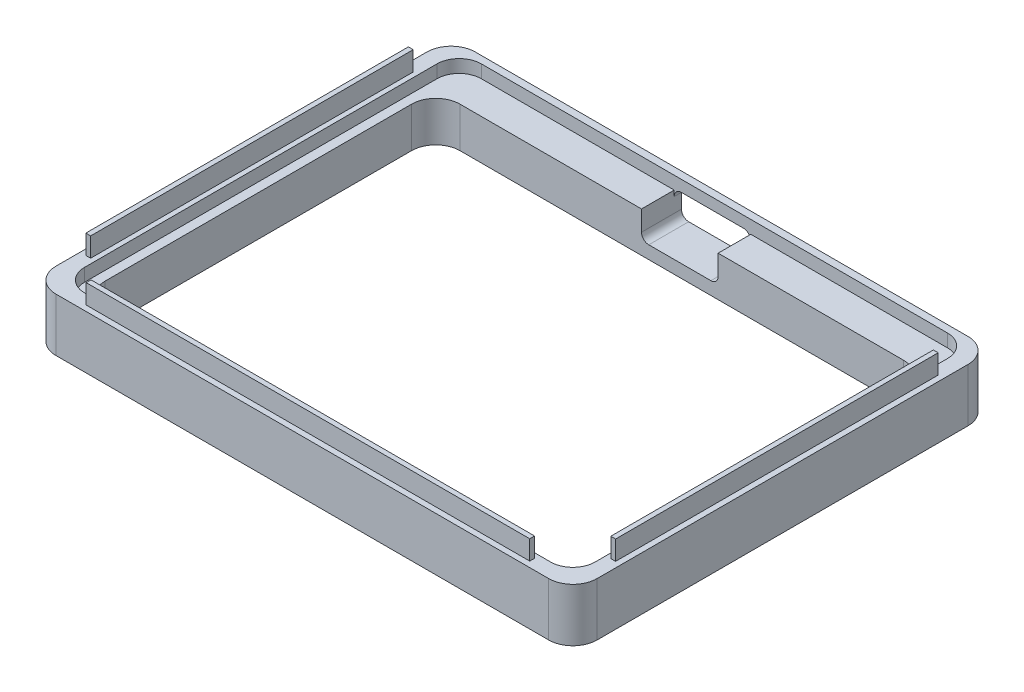
from build123d import *

# Parameters (mm, degrees)
BOSS_EXTRUDE1_DEPTH = 6.6
CUT_EXTRUDE1_DEPTH  = 6.6
CUT_EXTRUDE2_DEPTH  = 1.6
CUT_EXTRUDE3_DEPTH  = 11.6
SKETCH5_W           = 9.5
SKETCH5_H           = 4.05
CUT_EXTRUDE4_DEPTH  = 2
SKETCH6_W           = 0.75
SKETCH6_H           = 40
SKETCH6_W_2         = 55
SKETCH6_H_2         = 0.75
CUT_EXTRUDE5_DEPTH  = 2.6
SKETCH7_W           = 0.6
SKETCH7_H           = 40
SKETCH7_W_2         = 55
SKETCH7_H_2         = 0.6
BOSS_EXTRUDE2_DEPTH = 2.4


with BuildPart() as part:
    # Sketch1 → Boss-Extrude1 (new body)
    with BuildSketch(Plane(origin=(0, 0, 0), x_dir=(1, 0, 0), z_dir=(0, 1, 0))):
        with BuildLine():
            Line((3, 0), (64.1, 0))
            ThreePointArc((64.1, 0), (66.221320344, 0.878679656), (67.1, 3))
            Line((67.1, 3), (67.1, 49))
            ThreePointArc((67.1, 49), (66.221320344, 51.121320344), (64.1, 52))
            Line((64.1, 52), (3, 52))
            ThreePointArc((3, 52), (0.878679656, 51.121320344), (0, 49))
            Line((0, 49), (0, 3))
            ThreePointArc((0, 3), (0.878679656, 0.878679656), (3, 0))
        make_face()
    extrude(amount=BOSS_EXTRUDE1_DEPTH)

    # Sketch2 → Cut-Extrude1 (cut)
    with BuildSketch(Plane(origin=(0, 6.6, 0), x_dir=(1, 0, 0), z_dir=(0, 1, 0))):
        with BuildLine():
            Line((6.05, 3.05), (61.05, 3.05))
            ThreePointArc((61.05, 3.05), (63.171320344, 3.928679656), (64.05, 6.05))
            Line((64.05, 6.05), (64.05, 44.05))
            ThreePointArc((64.05, 44.05), (63.171320344, 46.171320344), (61.05, 47.05))
            Line((61.05, 47.05), (6.05, 47.05))
            ThreePointArc((6.05, 47.05), (3.928679656, 46.171320344), (3.05, 44.05))
            Line((3.05, 44.05), (3.05, 6.05))
            ThreePointArc((3.05, 6.05), (3.928679656, 3.928679656), (6.05, 3.05))
        make_face()
    extrude(amount=-CUT_EXTRUDE1_DEPTH, mode=Mode.SUBTRACT)

    # Sketch3 → Cut-Extrude2 (cut)
    with BuildSketch(Plane(origin=(0, 6.6, 0), x_dir=(1, 0, 0), z_dir=(0, 1, 0))):
        with BuildLine():
            Line((4.65, 51.1), (62.45, 51.1))
            ThreePointArc((62.45, 51.1), (64.394543648, 50.294543648), (65.2, 48.35))
            Line((65.2, 48.35), (65.2, 4.65))
            ThreePointArc((65.2, 4.65), (64.394543648, 2.705456352), (62.45, 1.9))
            Line((62.45, 1.9), (4.65, 1.9))
            ThreePointArc((4.65, 1.9), (2.705456352, 2.705456352), (1.9, 4.65))
            Line((1.9, 4.65), (1.9, 48.35))
            ThreePointArc((1.9, 48.35), (2.705456352, 50.294543648), (4.65, 51.1))
        make_face()
    extrude(amount=-CUT_EXTRUDE2_DEPTH, mode=Mode.SUBTRACT)

    # Sketch4 → Cut-Extrude3 (cut)
    with BuildSketch(Plane(origin=(0, 0, -52), x_dir=(-1, 0, 0), z_dir=(0, 0, -1))):
        with BuildLine():
            Line((-37.16, 5.2), (-29.46, 5.2))
            ThreePointArc((-29.46, 5.2), (-28.823603897, 4.936396103), (-28.56, 4.3))
            Line((-28.56, 4.3), (-28.56, 2.5))
            ThreePointArc((-28.56, 2.5), (-28.823603897, 1.863603897), (-29.46, 1.6))
            Line((-29.46, 1.6), (-37.16, 1.6))
            ThreePointArc((-37.16, 1.6), (-37.796396103, 1.863603897), (-38.06, 2.5))
            Line((-38.06, 2.5), (-38.06, 4.3))
            ThreePointArc((-38.06, 4.3), (-37.796396103, 4.936396103), (-37.16, 5.2))
        make_face()
    extrude(amount=-CUT_EXTRUDE3_DEPTH, mode=Mode.SUBTRACT)

    # Sketch5 → Cut-Extrude4 (cut)
    with BuildSketch(Plane(origin=(0, 5, 0), x_dir=(1, 0, 0), z_dir=(0, 1, 0))):
        with Locations((33.31, 49.075)):
            Rectangle(SKETCH5_W, SKETCH5_H)
    extrude(amount=-CUT_EXTRUDE4_DEPTH, mode=Mode.SUBTRACT)

    # Sketch6 → Cut-Extrude5 (cut)
    with BuildSketch(Plane.XZ):
        with Locations((65.975, -26)):
            Rectangle(SKETCH6_W, SKETCH6_H)
        with Locations((1.125, -26)):
            Rectangle(SKETCH6_W, SKETCH6_H)
        with Locations((33.55, -1.125)):
            Rectangle(SKETCH6_W_2, SKETCH6_H_2)
    extrude(amount=-CUT_EXTRUDE5_DEPTH, mode=Mode.SUBTRACT)

    # Sketch7 → Boss-Extrude2 (add)
    with BuildSketch(Plane(origin=(0, 6.6, 0), x_dir=(1, 0, 0), z_dir=(0, 1, 0))):
        with Locations((1, 26)):
            Rectangle(SKETCH7_W, SKETCH7_H)
        with Locations((33.55, 1)):
            Rectangle(SKETCH7_W_2, SKETCH7_H_2)
        with Locations((66.1, 26)):
            Rectangle(SKETCH7_W, SKETCH7_H)
    extrude(amount=BOSS_EXTRUDE2_DEPTH)


solid = part.part
